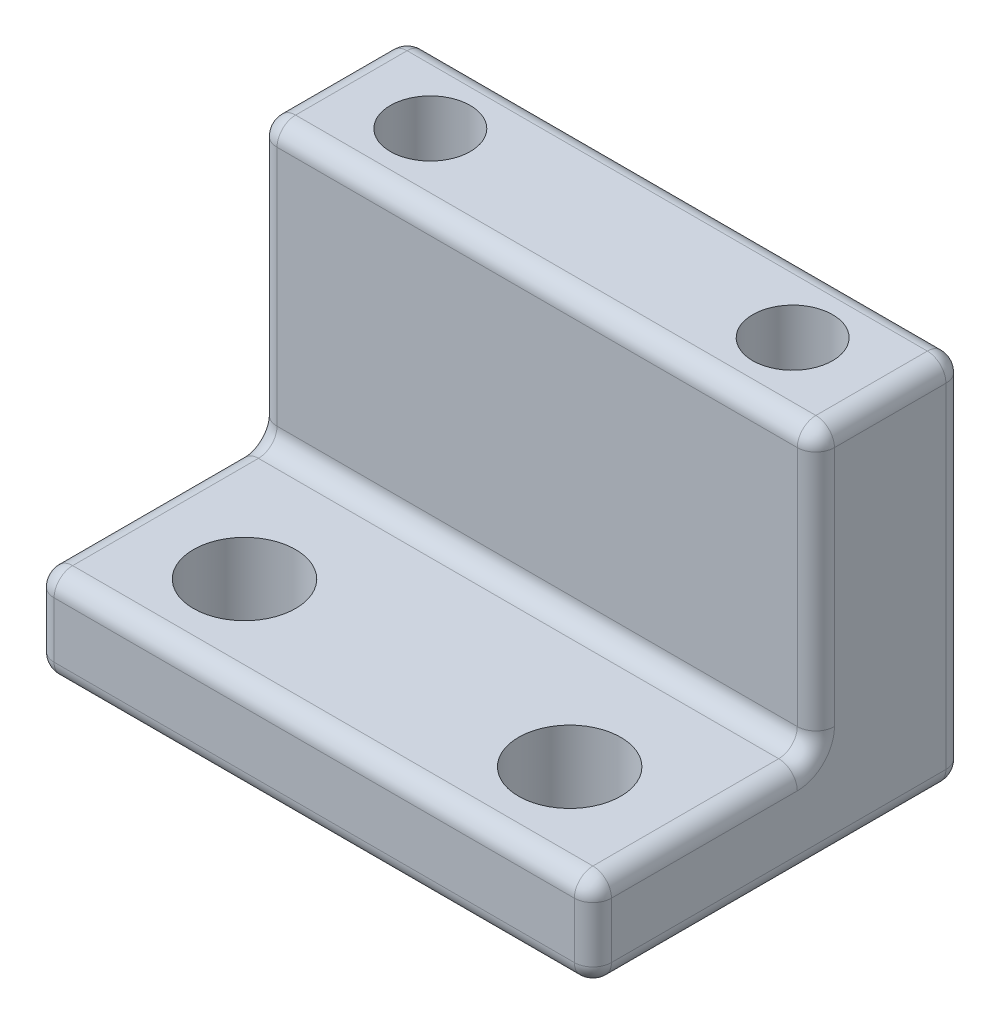
from build123d import *

# Parameters (mm, degrees)
SKETCH1_W           = 30
SKETCH1_H           = 20
SKETCH1_R           = 2.75
BOSS_EXTRUDE1_DEPTH = 5
SKETCH2_W           = 30
SKETCH2_H           = 8
BOSS_EXTRUDE2_DEPTH = 15
SKETCH3_R           = 2.15
CUT_EXTRUDE1_DEPTH  = 6
FILLET1_R           = 1


with BuildPart() as part:
    # Sketch1 → Boss-Extrude1 (new body)
    with BuildSketch(Plane(origin=(0, 0, 0), x_dir=(1, 0, 0), z_dir=(0, 1, 0))):
        with Locations((15, 10)):
            Rectangle(SKETCH1_W, SKETCH1_H)
        with Locations(Location((6.25, 5, 0), (0, 0, 270))):
            Circle(SKETCH1_R, mode=Mode.SUBTRACT)
        with Locations(Location((23.75, 5, 0), (0, 0, 270))):
            Circle(SKETCH1_R, mode=Mode.SUBTRACT)
    extrude(amount=BOSS_EXTRUDE1_DEPTH)

    # Sketch2 → Boss-Extrude2 (add)
    with BuildSketch(Plane(origin=(0, 5, 0), x_dir=(1, 0, 0), z_dir=(0, 1, 0))):
        with Locations((15, 16)):
            Rectangle(SKETCH2_W, SKETCH2_H)
    extrude(amount=BOSS_EXTRUDE2_DEPTH)

    # Sketch3 → Cut-Extrude1 (cut)
    with BuildSketch(Plane(origin=(0, 20, 0), x_dir=(1, 0, 0), z_dir=(0, 1, 0))):
        with Locations(Location((5.25, 16, 0), (0, 0, 270))):
            Circle(SKETCH3_R)
        with Locations(Location((24.75, 16, 0), (0, 0, 270))):
            Circle(SKETCH3_R)
    extrude(amount=-CUT_EXTRUDE1_DEPTH, mode=Mode.SUBTRACT)

    # Fillet1
    fillet1_edges = [part.edges().sort_by_distance(p)[0] for p in [
        (30, 5, -6),
        (0, 5, -6),
        (15, 5, -12),
        (0, 12.5, -12),
        (30, 12.5, -12),
        (0, 20, -16),
        (15, 20, -12),
        (30, 20, -16),
        (15, 20, -20),
        (15, 0, -20),
        (30, 0, -10),
        (15, 0, 0),
        (0, 0, -10),
        (0, 10, -20),
        (30, 10, -20),
        (30, 2.5, 0),
        (0, 2.5, 0),
        (15, 5, 0),
    ]]
    fillet(fillet1_edges, radius=FILLET1_R)


solid = part.part
